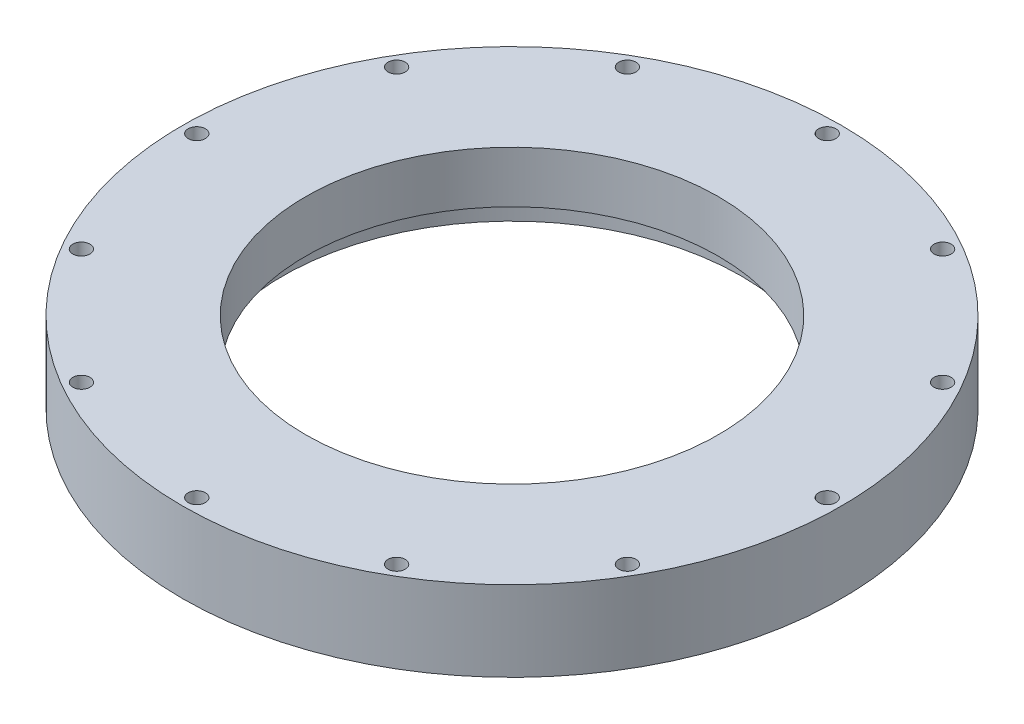
from build123d import *

# Parameters (mm, degrees)
SKETCH1_R           = 57.5
SKETCH1_R_2         = 40
SKETCH1_R_3         = 1.5
BOSS_EXTRUDE1_DEPTH = 14
SKETCH2_R           = 42.5
SKETCH2_R_2         = 36
BOSS_EXTRUDE2_DEPTH = 9
SKETCH3_R           = 1.5
CUT_EXTRUDE1_DEPTH  = 5


with BuildPart() as part:
    # Sketch1 → Boss-Extrude1 (new body)
    with BuildSketch(Plane(origin=(0, 0, 0), x_dir=(1, 0, 0), z_dir=(0, 1, 0))):
        with Locations(Location((0, 0, 0), (0, 0, 270))):
            Circle(SKETCH1_R)
        with Locations(Location((0, 0, 0), (0, 0, 270))):
            Circle(SKETCH1_R_2, mode=Mode.SUBTRACT)
        with Locations(Location((0, 55, 0), (0, 0, 270))):
            Circle(SKETCH1_R_3, mode=Mode.SUBTRACT)
        with Locations(Location((27.5, 47.631397208, 0), (0, 0, 270))):
            Circle(SKETCH1_R_3, mode=Mode.SUBTRACT)
        with Locations(Location((47.631397208, 27.5, 0), (0, 0, 270))):
            Circle(SKETCH1_R_3, mode=Mode.SUBTRACT)
        with Locations(Location((55, 0, 0), (0, 0, 270))):
            Circle(SKETCH1_R_3, mode=Mode.SUBTRACT)
        with Locations(Location((47.631397208, -27.5, 0), (0, 0, 270))):
            Circle(SKETCH1_R_3, mode=Mode.SUBTRACT)
        with Locations(Location((27.5, -47.631397208, 0), (0, 0, 270))):
            Circle(SKETCH1_R_3, mode=Mode.SUBTRACT)
        with Locations(Location((0, -55, 0), (0, 0, 270))):
            Circle(SKETCH1_R_3, mode=Mode.SUBTRACT)
        with Locations(Location((-27.5, -47.631397208, 0), (0, 0, 270))):
            Circle(SKETCH1_R_3, mode=Mode.SUBTRACT)
        with Locations(Location((-47.631397208, -27.5, 0), (0, 0, 270))):
            Circle(SKETCH1_R_3, mode=Mode.SUBTRACT)
        with Locations(Location((-55, 0, 0), (0, 0, 270))):
            Circle(SKETCH1_R_3, mode=Mode.SUBTRACT)
        with Locations(Location((-47.631397208, 27.5, 0), (0, 0, 270))):
            Circle(SKETCH1_R_3, mode=Mode.SUBTRACT)
        with Locations(Location((-27.5, 47.631397208, 0), (0, 0, 270))):
            Circle(SKETCH1_R_3, mode=Mode.SUBTRACT)
    extrude(amount=BOSS_EXTRUDE1_DEPTH)

    # Sketch2 → Boss-Extrude2 (add)
    with BuildSketch(Plane(origin=(0, 14, 0), x_dir=(1, 0, 0), z_dir=(0, 1, 0))):
        Circle(SKETCH2_R)
        with Locations(Location((0, 0, 0), (0, 0, 270))):
            Circle(SKETCH2_R_2, mode=Mode.SUBTRACT)
    extrude(amount=-BOSS_EXTRUDE2_DEPTH)

    # Sketch3 → Cut-Extrude1 (cut)
    with BuildSketch(Plane.XZ):
        with Locations(Location((0, 45, 0), (0, 0, 270))):
            Circle(SKETCH3_R)
        with Locations(Location((24.328836786, 37.856408977, 0), (0, 0, 270))):
            Circle(SKETCH3_R)
        with Locations(Location((40.933439791, 18.693675585, 0), (0, 0, 270))):
            Circle(SKETCH3_R)
        with Locations(Location((44.541964885, -6.404167722, 0), (0, 0, 270))):
            Circle(SKETCH3_R)
        with Locations(Location((34.008730846, -29.468733028, 0), (0, 0, 270))):
            Circle(SKETCH3_R)
        with Locations(Location((12.677965058, -43.177183813, 0), (0, 0, 270))):
            Circle(SKETCH3_R)
        with Locations(Location((-12.677965058, -43.177183813, 0), (0, 0, 270))):
            Circle(SKETCH3_R)
        with Locations(Location((-34.008730846, -29.468733028, 0), (0, 0, 270))):
            Circle(SKETCH3_R)
        with Locations(Location((-44.541964885, -6.404167722, 0), (0, 0, 270))):
            Circle(SKETCH3_R)
        with Locations(Location((-40.933439791, 18.693675585, 0), (0, 0, 270))):
            Circle(SKETCH3_R)
        with Locations(Location((-24.328836786, 37.856408977, 0), (0, 0, 270))):
            Circle(SKETCH3_R)
    extrude(amount=-CUT_EXTRUDE1_DEPTH, mode=Mode.SUBTRACT)


solid = part.part
